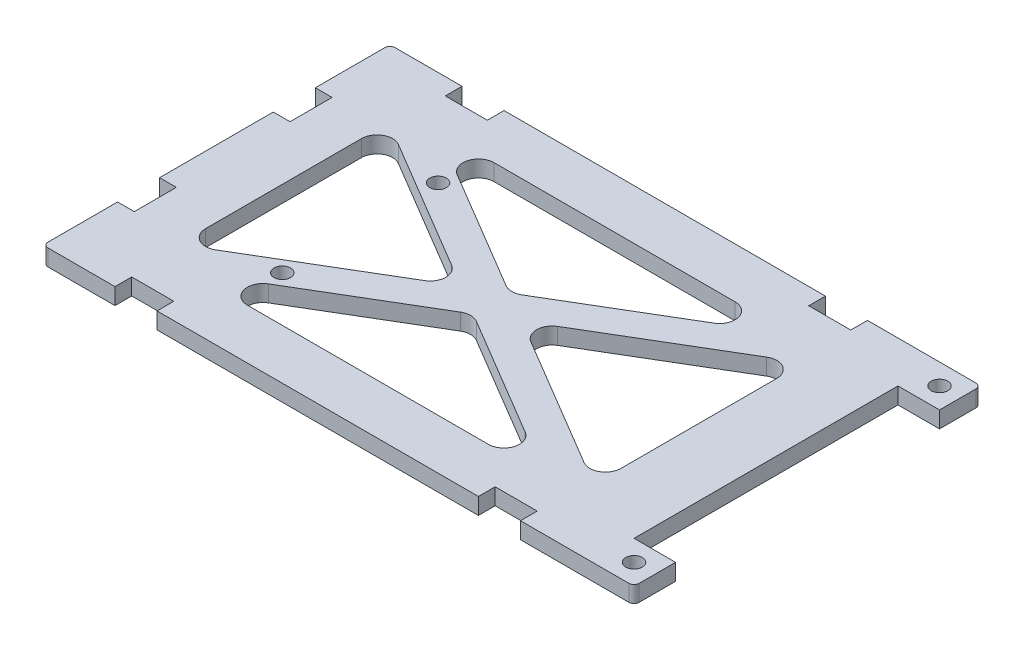
from build123d import *

# Parameters (mm, degrees)
SKETCH1_W                = 105.85
SKETCH1_H                = 66.84
BOSS_EXTRUDE1_DEPTH      = 3.175
SKETCH2_W                = 8.1
SKETCH2_H                = 3.225
SKETCH2_W_2              = 3.225
SKETCH2_H_2              = 8.1
CUT_EXTRUDE1_DEPTH       = 63.674018939
SKETCH3_W                = 8
SKETCH3_H                = 8
BOSS_EXTRUDE2_DEPTH      = 3.175
M3_CLEARANCE_HOLE1_D     = 3.2
M3_CLEARANCE_HOLE1_DEPTH = 12
M3_CLEARANCE_HOLE1_TIP   = 0.96137699
CUT_EXTRUDE2_DEPTH       = 70.56171828
FILLET1_R                = 1
FILLET2_R                = 3


with BuildPart() as part:
    # Sketch1 → Boss-Extrude1 (new body)
    with BuildSketch(Plane(origin=(0, 0, 0), x_dir=(1, 0, 0), z_dir=(0, 1, 0))):
        Rectangle(SKETCH1_W, SKETCH1_H)
    extrude(amount=BOSS_EXTRUDE1_DEPTH)

    # Sketch2 → Cut-Extrude1 (cut, through all)
    with BuildSketch(Plane(origin=(0, 3.175, 0), x_dir=(1, 0, 0), z_dir=(0, 1, 0))):
        with Locations((-35, 31.8075)):
            Rectangle(SKETCH2_W, SKETCH2_H)
        with Locations((35, 31.8075)):
            Rectangle(SKETCH2_W, SKETCH2_H)
        with Locations((35, -31.8075)):
            Rectangle(SKETCH2_W, SKETCH2_H)
        with Locations((-35, -31.8075)):
            Rectangle(SKETCH2_W, SKETCH2_H)
        with Locations((-51.3125, -15)):
            Rectangle(SKETCH2_W_2, SKETCH2_H_2)
        with Locations((-51.3125, 15)):
            Rectangle(SKETCH2_W_2, SKETCH2_H_2)
    extrude(amount=-CUT_EXTRUDE1_DEPTH, mode=Mode.SUBTRACT)

    # Sketch3 → Boss-Extrude2 (add)
    with BuildSketch(Plane(origin=(0, 3.175, 0), x_dir=(1, 0, 0), z_dir=(0, 1, 0))):
        with Locations((56.925, 29.42)):
            Rectangle(SKETCH3_W, SKETCH3_H)
        with Locations((56.925, -29.42)):
            Rectangle(SKETCH3_W, SKETCH3_H)
    extrude(amount=-BOSS_EXTRUDE2_DEPTH)

    # M3 Clearance Hole1
    with Locations(Plane(origin=(0, 3.175, 0), x_dir=(1, 0, 0), z_dir=(0, 1, 0))):
        with Locations((56.925, 29.42), (56.925, -29.42), (-25.245, 15), (-25.245, -15)):
            Hole(M3_CLEARANCE_HOLE1_D / 2, depth=M3_CLEARANCE_HOLE1_DEPTH)
            with Locations((0, 0, -(M3_CLEARANCE_HOLE1_DEPTH + M3_CLEARANCE_HOLE1_TIP / 2))):  # 118° drill point
                Cone(0, M3_CLEARANCE_HOLE1_D / 2, M3_CLEARANCE_HOLE1_TIP, mode=Mode.SUBTRACT)

    # Sketch10 → Cut-Extrude2 (cut, through all)
    with BuildSketch(Plane(origin=(0, 3.175, 0), x_dir=(1, 0, 0), z_dir=(0, 1, 0))):
        Polygon((-34.126976843, 23.767082591), (34.126976843, 23.767082591), (0, 3.489615661), align=None)
        Polygon((-40, 20.27746693), (-5.873023157, 0), (-40, -20.27746693), align=None)
        Polygon((-34.126976843, -23.767082591), (0, -3.489615661), (34.126976843, -23.767082591), align=None)
        Polygon((40, -20.27746693), (40, 20.27746693), (5.873023157, 0), align=None)
    extrude(amount=-CUT_EXTRUDE2_DEPTH, mode=Mode.SUBTRACT)

    # Fillet1
    fillet1_edges = [part.edges().sort_by_distance(p)[0] for p in [
        (60.925, 1.5875, -33.42),
        (60.925, 1.5875, 33.42),
        (-52.925, 1.5875, 33.42),
        (-52.925, 1.5875, -33.42),
    ]]
    fillet(fillet1_edges, radius=FILLET1_R)

    # Fillet2
    fillet2_edges = [part.edges().sort_by_distance(p)[0] for p in [
        (34.126976843, 1.5875, 23.767082591),
        (-34.126976843, 1.5875, 23.767082591),
        (0, 1.5875, 3.489615661),
        (-40, 1.5875, 20.27746693),
        (-40, 1.5875, -20.27746693),
        (-5.873023157, 1.5875, 0),
        (40, 1.5875, 20.27746693),
        (5.873023157, 1.5875, 0),
        (40, 1.5875, -20.27746693),
        (0, 1.5875, -3.489615661),
        (-34.126976843, 1.5875, -23.767082591),
        (34.126976843, 1.5875, -23.767082591),
    ]]
    fillet(fillet2_edges, radius=FILLET2_R)


solid = part.part
